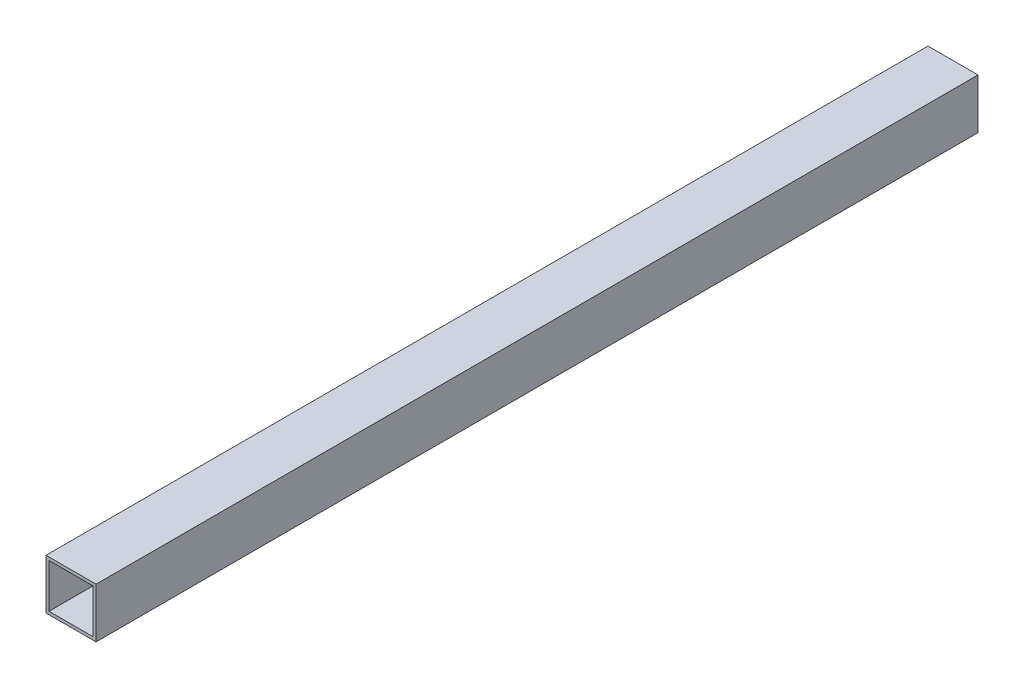
from build123d import *

# Parameters (mm, degrees)
SKETCH1_W           = 25.4
SKETCH1_H           = 25.4
SKETCH1_W_2         = 22.352
SKETCH1_H_2         = 22.352
EXTRUDE_THIN1_DEPTH = 447.675


with BuildPart() as part:
    # Sketch1 → Extrude-Thin1 (new body)
    with BuildSketch(Plane.XY):
        with Locations((-12.7, 12.7)):
            Rectangle(SKETCH1_W, SKETCH1_H)
        with Locations((-12.7, 12.7)):
            Rectangle(SKETCH1_W_2, SKETCH1_H_2, mode=Mode.SUBTRACT)
    extrude(amount=EXTRUDE_THIN1_DEPTH)


solid = part.part
